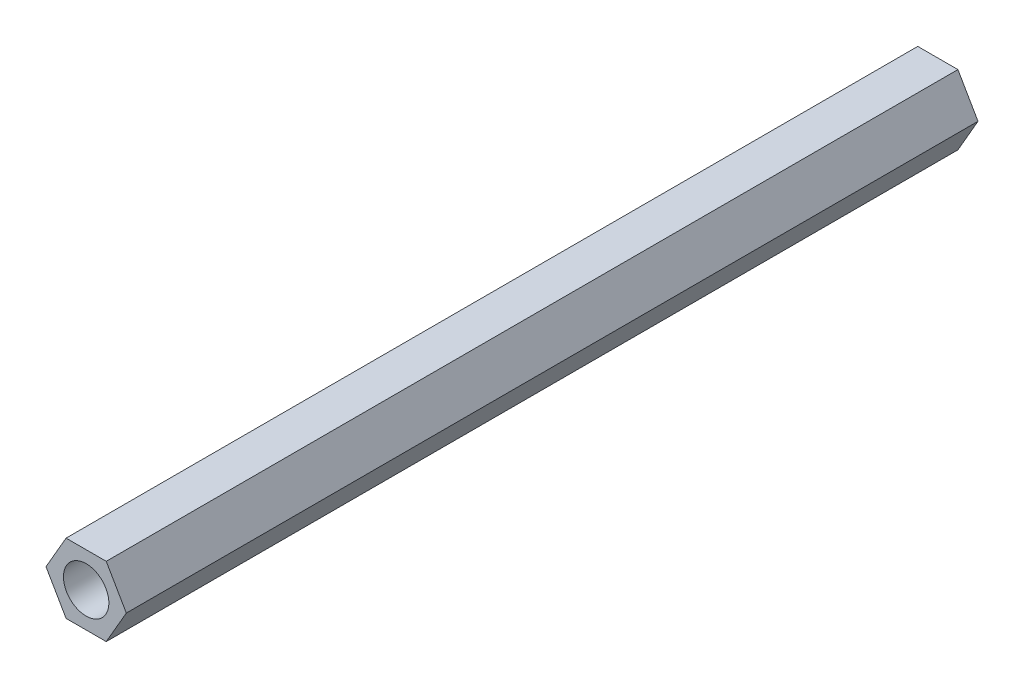
from build123d import *

# Parameters (mm, degrees)
SKETCH_1_R      = 1.6
EXTRUDE_1_DEPTH = 60


with BuildPart() as part:
    # 草图1 → 凸台-拉伸1 (new body)
    with BuildSketch(Plane.XY):
        Polygon((2.829016319, 0), (1.41450816, 2.45), (-1.41450816, 2.45), (-2.829016319, 0), (-1.41450816, -2.45), (1.41450816, -2.45), align=None)
        Circle(SKETCH_1_R, mode=Mode.SUBTRACT)
    extrude(amount=EXTRUDE_1_DEPTH)


solid = part.part
